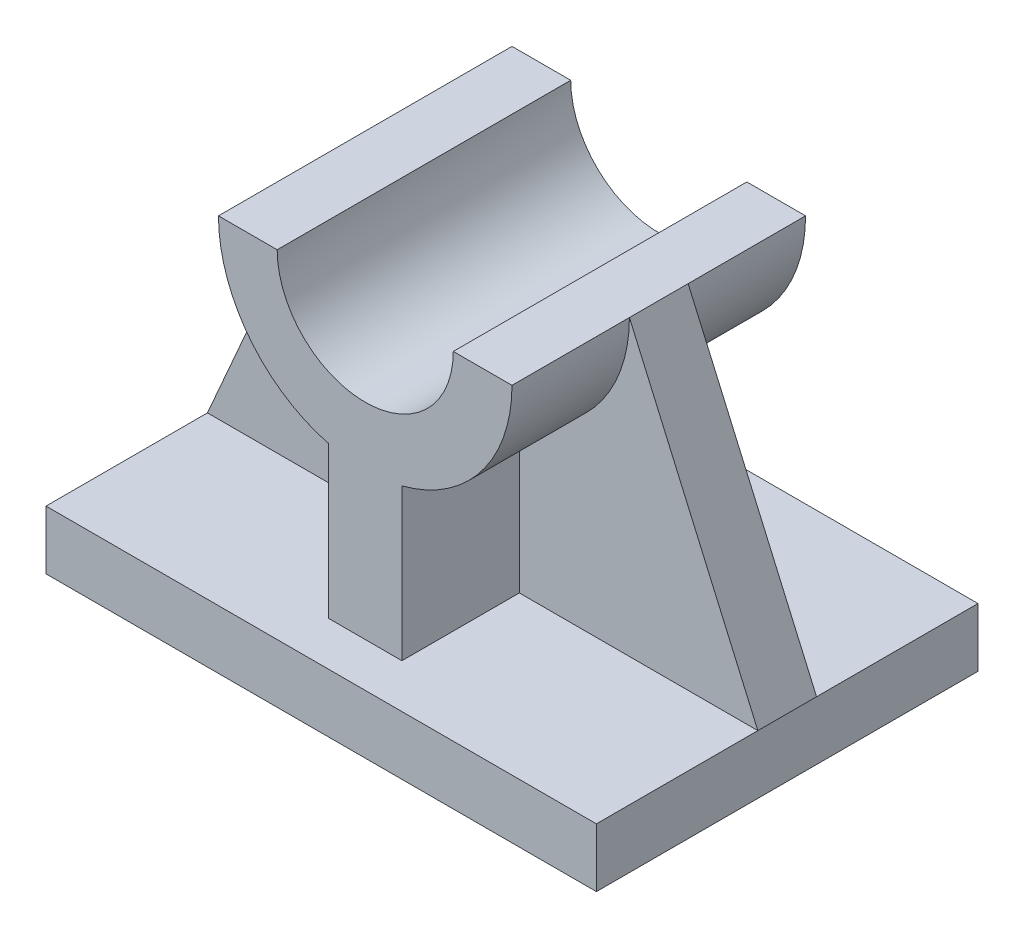
from build123d import *

# Parameters (mm, degrees)
BOSS_EXTRUDE1_DEPTH = 26
BOSS_EXTRUDE2_DEPTH = 20
BOSS_EXTRUDE3_DEPTH = 4


with BuildPart() as part:
    # Sketch1 → Boss-Extrude1 (new, symmetric)
    with BuildSketch(Plane.XY):
        Polygon((-5, 4), (-37.5, 4), (-37.5, -4), (37.5, -4), (37.5, 4), (5, 4), align=None)
    extrude(amount=BOSS_EXTRUDE1_DEPTH, both=True)

    # Sketch1<3> → Boss-Extrude2 (add, symmetric)
    with BuildSketch(Plane.XY):
        with BuildLine():
            Line((-12, 44), (-20, 44))
            ThreePointArc((-20, 44), (-15.811388301, 31.752551286), (-5, 24.635083269))
            Line((-5, 24.635083269), (-5, 4))
            Line((-5, 4), (5, 4))
            Line((5, 4), (5, 24.635083269))
            ThreePointArc((5, 24.635083269), (15.811388301, 31.752551286), (20, 44))
            Line((20, 44), (12, 44))
            ThreePointArc((12, 44), (0, 32), (-12, 44))
        make_face()
    extrude(amount=BOSS_EXTRUDE2_DEPTH, both=True)

    # Sketch1<4> → Boss-Extrude3 (add, symmetric)
    with BuildSketch(Plane.XY):
        with BuildLine():
            ThreePointArc((-5, 24.635083269), (-15.811388301, 31.752551286), (-20, 44))
            Line((-20, 44), (-37.5, 4))
            Line((-37.5, 4), (-5, 4))
            Line((-5, 4), (-5, 24.635083269))
        make_face()
        with BuildLine():
            ThreePointArc((20, 44), (15.811388301, 31.752551286), (5, 24.635083269))
            Line((5, 24.635083269), (5, 4))
            Line((5, 4), (37.5, 4))
            Line((37.5, 4), (20, 44))
        make_face()
    extrude(amount=BOSS_EXTRUDE3_DEPTH, both=True)


solid = part.part
